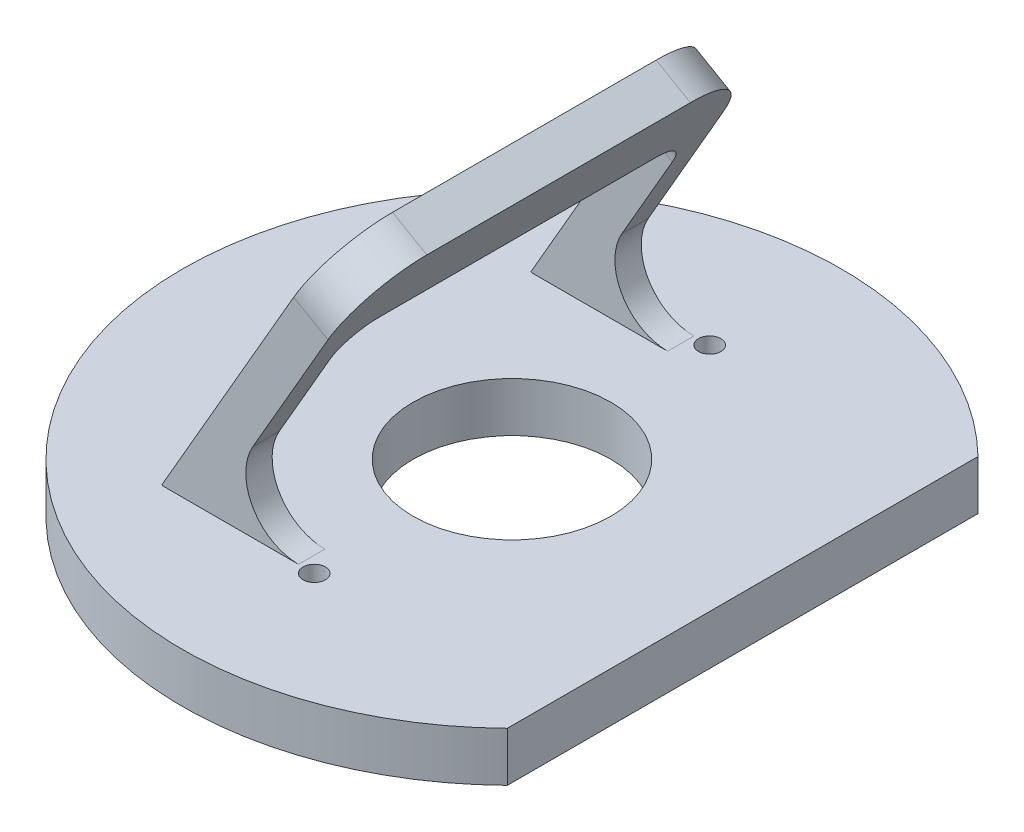
from build123d import *

# Parameters (mm, degrees)
SKETCH_9_R               = 30
EXTRUDE_3_DEPTH          = 15
EXTRUDE_4_DEPTH          = 12
FILLET_2_R               = 16
HOLE_WIZARD_M8_2_D       = 6.8
HOLE_WIZARD_M8_2_DEPTH   = 15
PATTERN_CIRCULAR_2_COUNT = 4


with BuildPart() as part:
    # 草图9 → 凸台-拉伸3 (new body)
    with BuildSketch(Plane(origin=(0, 0, 0), x_dir=(1, 0, 0), z_dir=(0, 1, 0))):
        with BuildLine():
            Line((70, 71.414284285), (70, -71.414284285))
            ThreePointArc((70, -71.414284285), (-100, 0), (70, 71.414284285))
        make_face()
        with Locations(Location((0, 0, 0), (0, 0, 270))):
            Circle(SKETCH_9_R, mode=Mode.SUBTRACT)
    extrude(amount=EXTRUDE_3_DEPTH)

    # 草图11 → 凸台-拉伸4 (add)
    with BuildSketch(Plane(origin=(-41.25, 23.815698604, 0), x_dir=(0, 0, 1), z_dir=(-0.8660254037844398, 0.499999999999998, 0))):
        with BuildLine():
            Line((-60, -9.97981973), (-60, 70.02018027))
            ThreePointArc((-60, 70.02018027), (-54.142135624, 84.162315894), (-40, 90.02018027))
            Line((-40, 90.02018027), (40, 90.02018027))
            ThreePointArc((40, 90.02018027), (54.142135624, 84.162315894), (60, 70.02018027))
            Line((60, 70.02018027), (60, -9.97981973))
            Line((60, -9.97981973), (52, -9.97981973))
            Line((52, -9.97981973), (52, 55.02018027))
            ThreePointArc((52, 55.02018027), (49.071067812, 62.091248082), (42, 65.02018027))
            Line((42, 65.02018027), (-42, 65.02018027))
            ThreePointArc((-42, 65.02018027), (-49.071067812, 62.091248082), (-52, 55.02018027))
            Line((-52, 55.02018027), (-52, -9.97981973))
            Line((-52, -9.97981973), (-60, -9.97981973))
        make_face()
    extrude(amount=-EXTRUDE_4_DEPTH)

    # 圆角2
    fillet_2_edges = [part.edges().sort_by_distance(p)[0] for p in [
        (-32.483339502, 15, -56),
        (-32.483339502, 15, 56),
    ]]
    fillet(fillet_2_edges, radius=FILLET_2_R)

    # M8 螺纹孔2
    with Locations(Plane(origin=(0, 15, 0), x_dir=(1, 0, 0), z_dir=(0, 1, 0))):
        with Locations((-60, 0)):
            hole_wizard_m8_2 = Hole(HOLE_WIZARD_M8_2_D / 2, depth=HOLE_WIZARD_M8_2_DEPTH)

    # 阵列(圆周)2: M8 螺纹孔2 ×4 about axis, 1 skipped
    pattern_circular_2_axis = Axis((0, 0, 0), (0, 1, 0))
    add([hole_wizard_m8_2.rotate(pattern_circular_2_axis, i * 360 / PATTERN_CIRCULAR_2_COUNT) for i in range(1, PATTERN_CIRCULAR_2_COUNT) if i not in (2,)], mode=Mode.SUBTRACT)


solid = part.part
